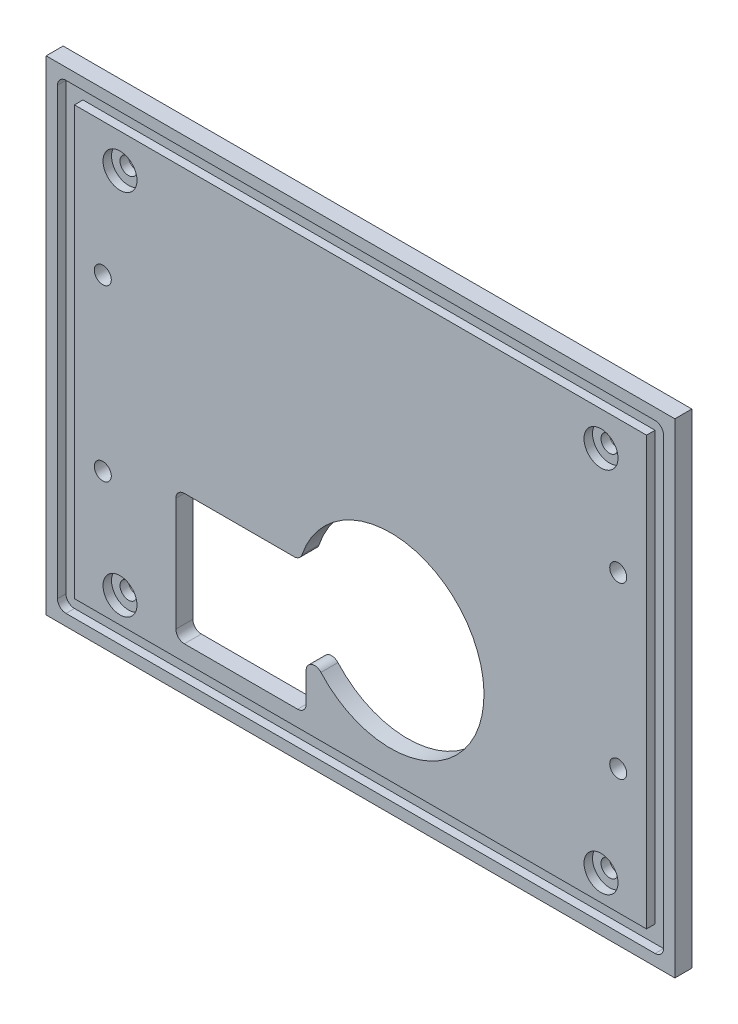
from build123d import *

# Parameters (mm, degrees)
SKETCH_9_W                                     = 111
SKETCH_9_H                                     = 84
BOTTOM_BASE_1P5MM_FULL_111X84_DEPTH            = 1.5
SKETCH_10_W                                    = 101
SKETCH_10_H                                    = 74
SKETCH_10_R                                    = 3
BOTTOM_CENTER_FULL_THICKNESS_EXCEPT_STAN_DEPTH = 3
SKETCH_11_W                                    = 111
SKETCH_11_H                                    = 2
BOTTOM_OUTER_FRONT_OVERHANG_FULL_3MM_DEPTH     = 3
SKETCH_12_W                                    = 111
SKETCH_12_H                                    = 2
BOTTOM_OUTER_REAR_OVERHANG_FULL_3MM_DEPTH      = 3
SKETCH_13_W                                    = 2
SKETCH_13_H                                    = 80
BOTTOM_OUTER_LEFT_OVERHANG_FULL_3MM_DEPTH      = 3
SKETCH_14_W                                    = 2
SKETCH_14_H                                    = 80
BOTTOM_OUTER_RIGHT_OVERHANG_FULL_3MM_DEPTH     = 3
SKETCH_16_R                                    = 1.5
BOTTOM_M3_THROUGH_3MM_DEPTH                    = 1.5
SKETCH_18_R                                    = 16.5
BOTTOM_BATTERY_THROUGH_CLEARANCE_DEPTH         = 3
SKETCH_20_W                                    = 23
SKETCH_20_H                                    = 23
BOTTOM_BUZZER_THROUGH_CUT_DEPTH                = 3
SKETCH_21_R                                    = 1.5
BOTTOM_CENTER_RAIL_M3_THROUGH_3MM_DEPTH        = 6
BOTTOM_FILL_OLD_REAR_RABBET_1P5MM_START        = 1.5
SKETCH_22_W                                    = 101
SKETCH_22_H                                    = 1.5
BOTTOM_FILL_OLD_REAR_RABBET_1P5MM_DEPTH        = 1.5
SKETCH_23_W                                    = 107
SKETCH_23_H                                    = 2
BOTTOM_NEW_REAR_RABBET_1P5MM_DEEP_DEPTH        = 1.5
SKETCH_24_W                                    = 111
SKETCH_24_H                                    = 1.5
BOTTOM_REAR_OVERHANG_EXTENSION_1P5MM_DEPTH     = 3
TOOL_D3_R1P5_BUZZER_CORNERS_R                  = 1.5
BOTTOM_REAR_RABBET_WIDTH_FIX_3MM_START         = 1.5
SKETCH_25_W                                    = 107
SKETCH_25_H                                    = 0.5
BOTTOM_REAR_RABBET_WIDTH_FIX_3MM_DEPTH         = 1.5
TOOL_D3_R1P5_BOTTOM_RABBET_OUTER_CORNERS_R     = 1.5


with BuildPart() as part:
    # Эскиз9 → bottom_base_1p5mm_full_111x84 (new body)
    with BuildSketch(Plane.XY):
        with Locations((53.5, 40)):
            Rectangle(SKETCH_9_W, SKETCH_9_H)
    extrude(amount=BOTTOM_BASE_1P5MM_FULL_111X84_DEPTH)

    # Эскиз10 → bottom_center_full_thickness_except_standoff_pockets (add)
    with BuildSketch(Plane.XY):
        with Locations((53.5, 40)):
            Rectangle(SKETCH_10_W, SKETCH_10_H)
        with Locations(Location((11.04, 7.54, 0), (0, 0, 180))):
            Circle(SKETCH_10_R, mode=Mode.SUBTRACT)
        with Locations(Location((95.96, 7.54, 0), (0, 0, 180))):
            Circle(SKETCH_10_R, mode=Mode.SUBTRACT)
        with Locations(Location((11.04, 72.46, 0), (0, 0, 180))):
            Circle(SKETCH_10_R, mode=Mode.SUBTRACT)
        with Locations(Location((95.96, 72.46, 0), (0, 0, 180))):
            Circle(SKETCH_10_R, mode=Mode.SUBTRACT)
    extrude(amount=BOTTOM_CENTER_FULL_THICKNESS_EXCEPT_STAN_DEPTH)

    # Эскиз11 → bottom_outer_front_overhang_full_3mm (add)
    with BuildSketch(Plane.XY):
        with Locations((53.5, -1)):
            Rectangle(SKETCH_11_W, SKETCH_11_H)
    extrude(amount=BOTTOM_OUTER_FRONT_OVERHANG_FULL_3MM_DEPTH)

    # Эскиз12 → bottom_outer_rear_overhang_full_3mm (add)
    with BuildSketch(Plane.XY):
        with Locations((53.5, 81)):
            Rectangle(SKETCH_12_W, SKETCH_12_H)
    extrude(amount=BOTTOM_OUTER_REAR_OVERHANG_FULL_3MM_DEPTH)

    # Эскиз13 → bottom_outer_left_overhang_full_3mm (add)
    with BuildSketch(Plane.XY):
        with Locations((-1, 40)):
            Rectangle(SKETCH_13_W, SKETCH_13_H)
    extrude(amount=BOTTOM_OUTER_LEFT_OVERHANG_FULL_3MM_DEPTH)

    # Эскиз14 → bottom_outer_right_overhang_full_3mm (add)
    with BuildSketch(Plane.XY):
        with Locations((108, 40)):
            Rectangle(SKETCH_14_W, SKETCH_14_H)
    extrude(amount=BOTTOM_OUTER_RIGHT_OVERHANG_FULL_3MM_DEPTH)

    # Эскиз16 → bottom_m3_through_3mm (cut)
    with BuildSketch(Plane.XY):
        with Locations(Location((11.04, 7.54, 0), (0, 0, 180))):
            Circle(SKETCH_16_R)
        with Locations(Location((95.96, 7.54, 0), (0, 0, 180))):
            Circle(SKETCH_16_R)
        with Locations(Location((11.04, 72.46, 0), (0, 0, 180))):
            Circle(SKETCH_16_R)
        with Locations(Location((95.96, 72.46, 0), (0, 0, 180))):
            Circle(SKETCH_16_R)
    extrude(amount=BOTTOM_M3_THROUGH_3MM_DEPTH, mode=Mode.SUBTRACT)

    # Эскиз18 → bottom_battery_through_clearance (cut)
    with BuildSketch(Plane.XY):
        with Locations(Location((58.8, 24.5, 0), (0, 0, 180))):
            Circle(SKETCH_18_R)
    extrude(amount=BOTTOM_BATTERY_THROUGH_CLEARANCE_DEPTH, mode=Mode.SUBTRACT)

    # Эскиз20 → bottom_buzzer_through_cut (cut)
    with BuildSketch(Plane.XY):
        with Locations((32.4, 17.3)):
            Rectangle(SKETCH_20_W, SKETCH_20_H)
    extrude(amount=BOTTOM_BUZZER_THROUGH_CUT_DEPTH, mode=Mode.SUBTRACT)

    # Эскиз21 → bottom_center_rail_m3_through_3mm (cut)
    with BuildSketch(Plane.XY):
        with Locations(Location((8, 25, 0), (0, 0, 180))):
            Circle(SKETCH_21_R)
        with Locations(Location((8, 55, 0), (0, 0, 180))):
            Circle(SKETCH_21_R)
        with Locations(Location((99, 25, 0), (0, 0, 180))):
            Circle(SKETCH_21_R)
        with Locations(Location((99, 55, 0), (0, 0, 180))):
            Circle(SKETCH_21_R)
    extrude(amount=BOTTOM_CENTER_RAIL_M3_THROUGH_3MM_DEPTH, mode=Mode.SUBTRACT)

    # Эскиз22 → bottom_fill_old_rear_rabbet_1p5mm (add)
    with BuildSketch(Plane.XY.offset(BOTTOM_FILL_OLD_REAR_RABBET_1P5MM_START)):
        with Locations((53.5, 77.75)):
            Rectangle(SKETCH_22_W, SKETCH_22_H)
    extrude(amount=BOTTOM_FILL_OLD_REAR_RABBET_1P5MM_DEPTH)

    # Эскиз23 → bottom_new_rear_rabbet_1p5mm_deep (cut)
    with BuildSketch(Plane.XY.offset(3)):
        with Locations((53.5, 81)):
            Rectangle(SKETCH_23_W, SKETCH_23_H)
    extrude(amount=-BOTTOM_NEW_REAR_RABBET_1P5MM_DEEP_DEPTH, mode=Mode.SUBTRACT)

    # Эскиз24 → bottom_rear_overhang_extension_1p5mm (add)
    with BuildSketch(Plane.XY):
        with Locations((53.5, 82.75)):
            Rectangle(SKETCH_24_W, SKETCH_24_H)
    extrude(amount=BOTTOM_REAR_OVERHANG_EXTENSION_1P5MM_DEPTH)

    # tool_D3_R1p5_buzzer_corners
    tool_d3_r1p5_buzzer_corners_edges = [part.edges().sort_by_distance(p)[0] for p in [
        (42.870153799, 28.8, 1.5),
        (43.9, 17.411981941, 1.5),
        (20.9, 28.8, 1.5),
        (20.9, 5.8, 1.5),
        (43.9, 5.8, 1.5),
    ]]
    fillet(tool_d3_r1p5_buzzer_corners_edges, radius=TOOL_D3_R1P5_BUZZER_CORNERS_R)

    # Эскиз25 → bottom_rear_rabbet_width_fix_3mm (add)
    with BuildSketch(Plane.XY.offset(BOTTOM_REAR_RABBET_WIDTH_FIX_3MM_START)):
        with Locations((53.5, 81.75)):
            Rectangle(SKETCH_25_W, SKETCH_25_H)
    extrude(amount=BOTTOM_REAR_RABBET_WIDTH_FIX_3MM_DEPTH)

    # tool_D3_R1p5_bottom_rabbet_outer_corners
    tool_d3_r1p5_bottom_rabbet_outer_corners_edges = [part.edges().sort_by_distance(p)[0] for p in [
        (107, 0, 2.25),
        (0, 81.5, 2.25),
        (107, 81.5, 2.25),
        (0, 0, 2.25),
    ]]
    fillet(tool_d3_r1p5_bottom_rabbet_outer_corners_edges, radius=TOOL_D3_R1P5_BOTTOM_RABBET_OUTER_CORNERS_R)


solid = part.part
